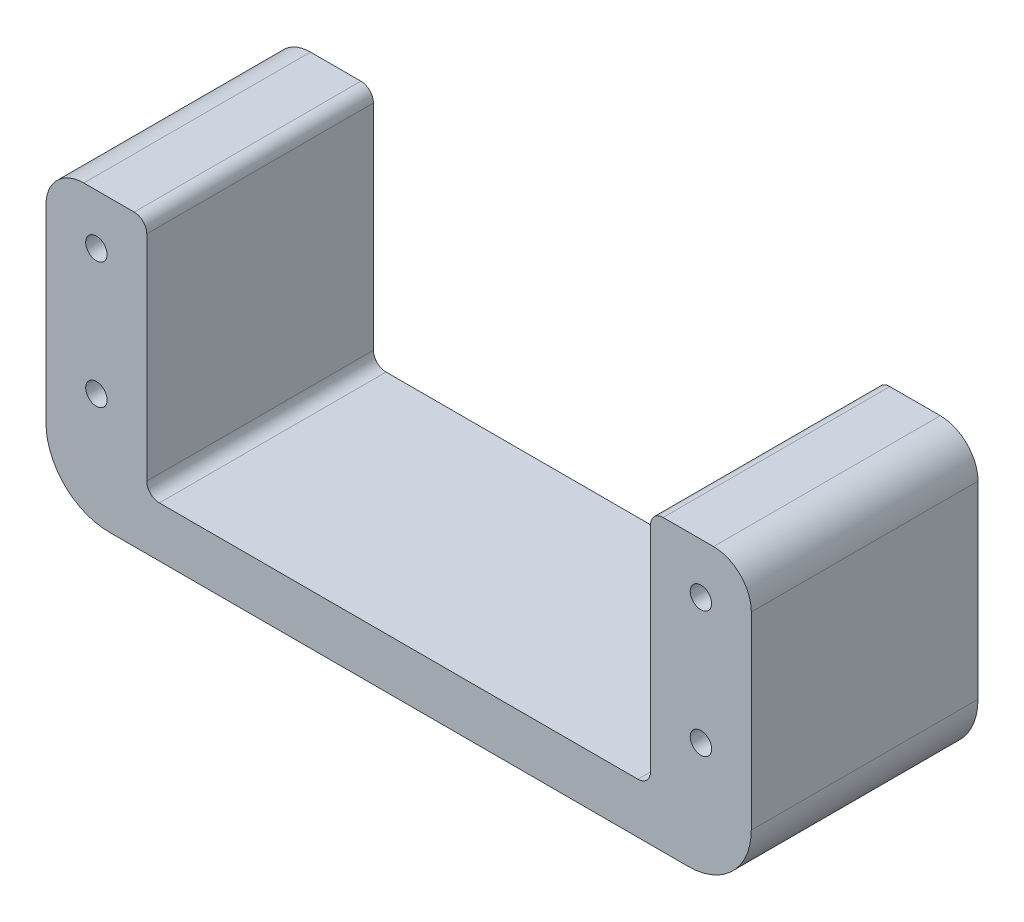
from build123d import *

# Parameters (mm, degrees)
ESQUISSE1_R        = 0.85
BOSS_EXTRU_1_DEPTH = 18
CONG_1_R           = 1
CONG_2_R           = 3
CONG_3_R           = 5


with BuildPart() as part:
    # Esquisse1 → Boss.-Extru.1 (new body)
    with BuildSketch(Plane.XY):
        Polygon((20, 23), (28, 23), (28, 0), (-28, 0), (-28, 23), (-20, 23), (-20, 4), (20, 4), align=None)
        with Locations((-24, 19)):
            Circle(ESQUISSE1_R, mode=Mode.SUBTRACT)
        with Locations((-24, 9)):
            Circle(ESQUISSE1_R, mode=Mode.SUBTRACT)
        with Locations(Location((24, 9, 0), (0, 0, 180))):
            Circle(ESQUISSE1_R, mode=Mode.SUBTRACT)
        with Locations(Location((24, 19, 0), (0, 0, 180))):
            Circle(ESQUISSE1_R, mode=Mode.SUBTRACT)
    extrude(amount=BOSS_EXTRU_1_DEPTH)

    # Congé1
    cong_1_edges = [part.edges().sort_by_distance(p)[0] for p in [
        (-20, 23, 9),
        (-20, 4, 9),
        (20, 4, 9),
        (20, 23, 9),
    ]]
    fillet(cong_1_edges, radius=CONG_1_R)

    # Congé2
    cong_2_edges = [part.edges().sort_by_distance(p)[0] for p in [
        (-28, 23, 9),
        (28, 23, 9),
    ]]
    fillet(cong_2_edges, radius=CONG_2_R)

    # Congé3
    cong_3_edges = [part.edges().sort_by_distance(p)[0] for p in [
        (28, 0, 9),
        (-28, 0, 9),
    ]]
    fillet(cong_3_edges, radius=CONG_3_R)


solid = part.part
